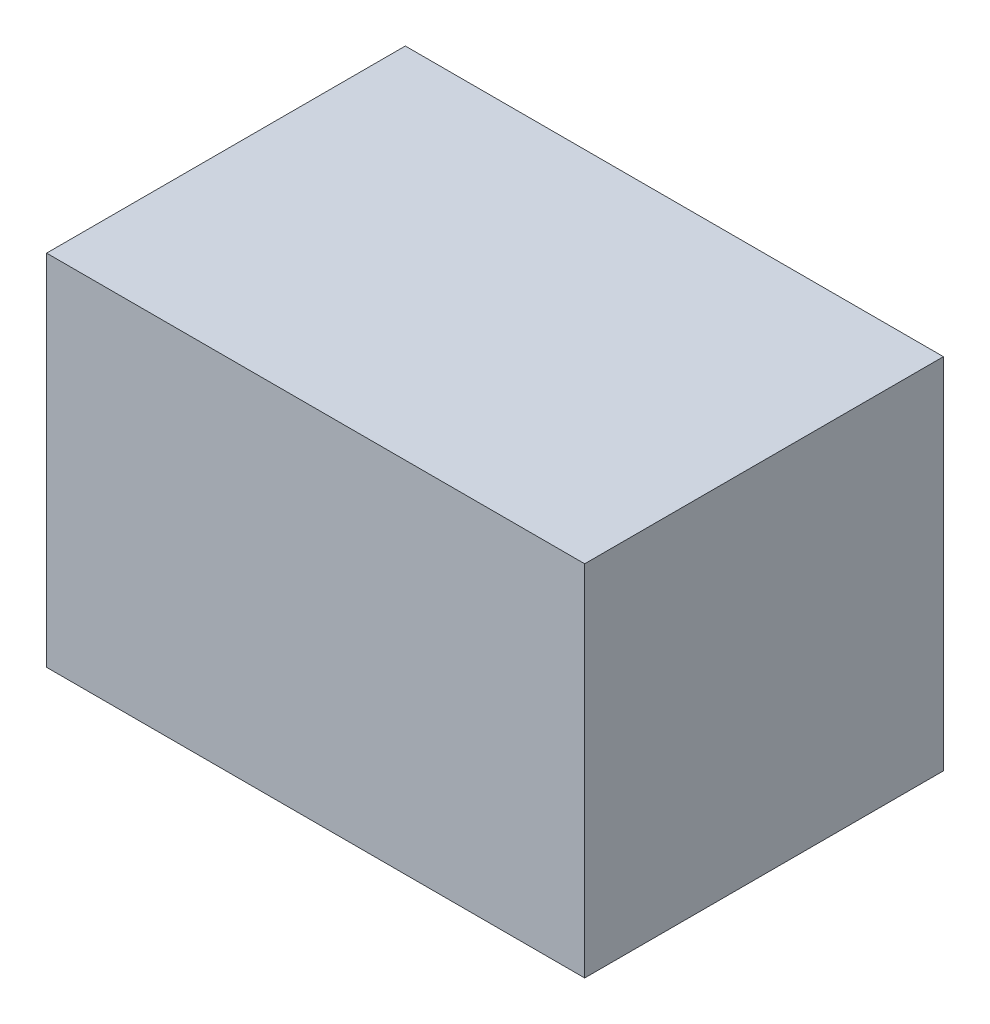
from build123d import *

# Parameters (mm, degrees)
PACK_KAPAK_SWITCH_1_1_START = -620
SKETCH1_W                   = 30
SKETCH1_H                   = 20
PACK_KAPAK_SWITCH_1_1_DEPTH = 20


with BuildPart() as part:
    # Sketch1 → PACK_kapak_switch_1_1 (new body)
    with BuildSketch(Plane.XY.offset(PACK_KAPAK_SWITCH_1_1_START)):
        with Locations((115, 710)):
            Rectangle(SKETCH1_W, SKETCH1_H)
    extrude(amount=-PACK_KAPAK_SWITCH_1_1_DEPTH)


solid = part.part
